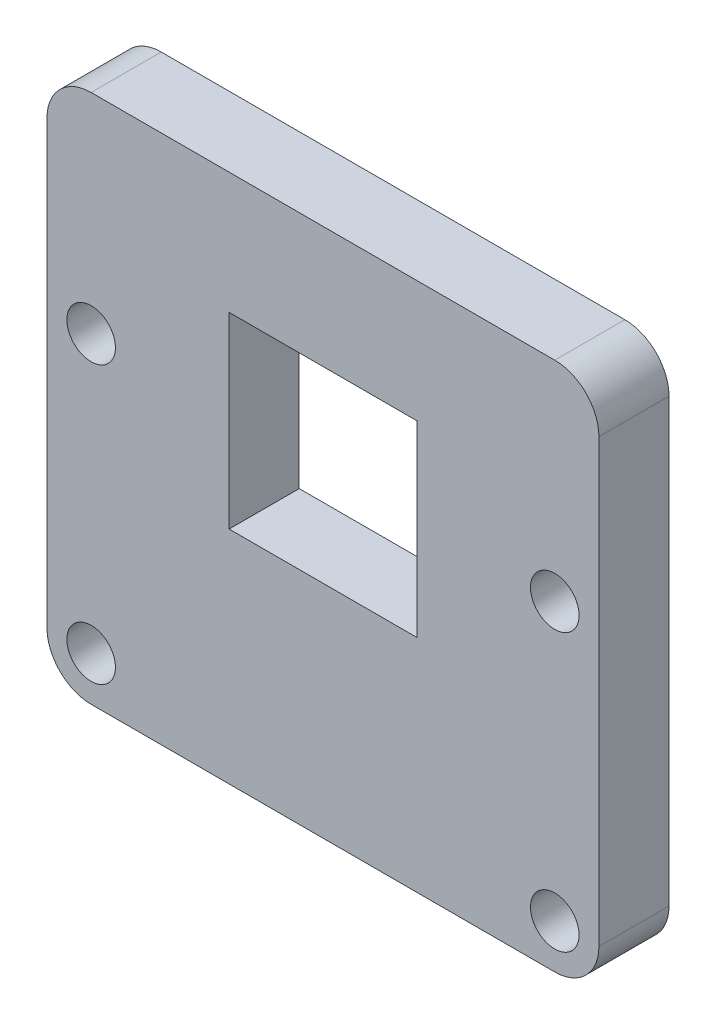
from build123d import *

# Parameters (mm, degrees)
SKETCH1_R           = 1.1
SKETCH1_W           = 8.5
SKETCH1_H           = 8.5
BOSS_EXTRUDE1_DEPTH = 3.175


with BuildPart() as part:
    # Sketch1 → Boss-Extrude1 (new body)
    with BuildSketch(Plane.XY):
        with BuildLine():
            Line((-10.705332644, 7.071510672), (10.294667356, 7.071510672))
            ThreePointArc((10.294667356, 7.071510672), (11.708880919, 6.485724235), (12.294667356, 5.071510672))
            Line((12.294667356, 5.071510672), (12.294667356, -14.928489328))
            ThreePointArc((12.294667356, -14.928489328), (11.708880919, -16.34270289), (10.294667356, -16.928489328))
            Line((10.294667356, -16.928489328), (-10.705332644, -16.928489328))
            ThreePointArc((-10.705332644, -16.928489328), (-12.119546206, -16.34270289), (-12.705332644, -14.928489328))
            Line((-12.705332644, -14.928489328), (-12.705332644, 5.071510672))
            ThreePointArc((-12.705332644, 5.071510672), (-12.119546206, 6.485724235), (-10.705332644, 7.071510672))
        make_face()
        with Locations((-10.705332644, -14.928489328)):
            Circle(SKETCH1_R, mode=Mode.SUBTRACT)
        with Locations((-10.705332644, -2.390489328)):
            Circle(SKETCH1_R, mode=Mode.SUBTRACT)
        with Locations((10.294667356, -2.390489328)):
            Circle(SKETCH1_R, mode=Mode.SUBTRACT)
        with Locations((10.294667356, -14.928489328)):
            Circle(SKETCH1_R, mode=Mode.SUBTRACT)
        with Locations((-0.205332644, -2.678489328)):
            Rectangle(SKETCH1_W, SKETCH1_H, mode=Mode.SUBTRACT)
    extrude(amount=-BOSS_EXTRUDE1_DEPTH)


solid = part.part
